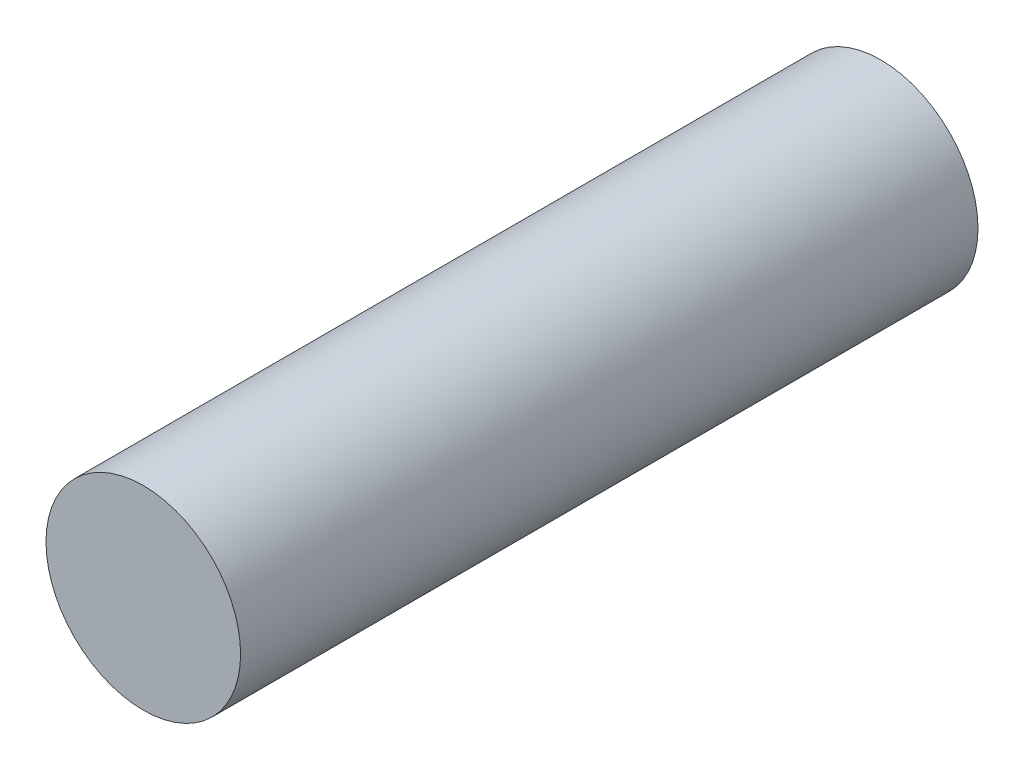
from build123d import *

# Parameters (mm, degrees)
SKETCH1_R           = 30.1625
BOSS_EXTRUDE1_DEPTH = 228.6


with BuildPart() as part:
    # Sketch1 → Boss-Extrude1 (new body)
    with BuildSketch(Plane.XY):
        Circle(SKETCH1_R)
    extrude(amount=BOSS_EXTRUDE1_DEPTH)


solid = part.part
